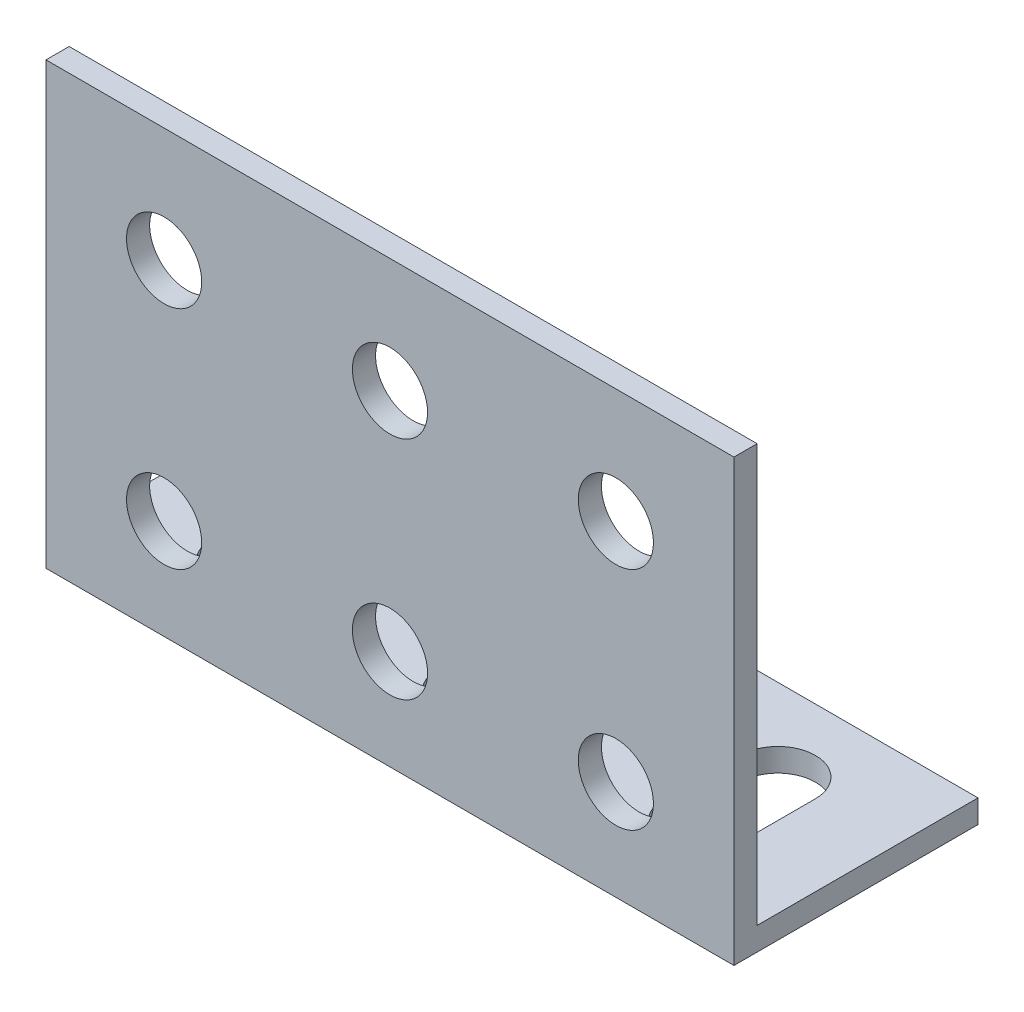
from build123d import *

# Parameters (mm, degrees)
SKETCH1_W           = 38.62
SKETCH1_H           = 24.72
SKETCH1_R           = 2.11
BOSS_EXTRUDE1_DEPTH = 1.3
SKETCH2_W           = 38.62
SKETCH2_H           = 13.7
BOSS_EXTRUDE2_DEPTH = 1.3


with BuildPart() as part:
    # Sketch1 → Boss-Extrude1 (new body)
    with BuildSketch(Plane.XY):
        with Locations((-21.272112536, 4.996529857)):
            Rectangle(SKETCH1_W, SKETCH1_H)
        with Locations((-33.952112536, 10.926529857)):
            Circle(SKETCH1_R, mode=Mode.SUBTRACT)
        with Locations((-21.272112536, 10.926529857)):
            Circle(SKETCH1_R, mode=Mode.SUBTRACT)
        with Locations((-8.592112536, 10.926529857)):
            Circle(SKETCH1_R, mode=Mode.SUBTRACT)
        with Locations((-21.272112536, -1.753470143)):
            Circle(SKETCH1_R, mode=Mode.SUBTRACT)
        with Locations((-8.592112536, -1.753470143)):
            Circle(SKETCH1_R, mode=Mode.SUBTRACT)
        with Locations((-33.952112536, -1.753470143)):
            Circle(SKETCH1_R, mode=Mode.SUBTRACT)
    extrude(amount=-BOSS_EXTRUDE1_DEPTH)

    # Sketch2 → Boss-Extrude2 (add)
    with BuildSketch(Plane.XZ.offset(7.363470143)):
        with Locations((-21.272112536, -6.85)):
            Rectangle(SKETCH2_W, SKETCH2_H)
        with BuildLine():
            Line((-31.842112536, -4.791404459), (-31.842112536, -9.091404459))
            ThreePointArc((-31.842112536, -9.091404459), (-33.952112536, -11.201404459), (-36.062112536, -9.091404459))
            Line((-36.062112536, -9.091404459), (-36.062112536, -4.791404459))
            ThreePointArc((-36.062112536, -4.791404459), (-33.952112536, -2.681404459), (-31.842112536, -4.791404459))
        make_face(mode=Mode.SUBTRACT)
        with BuildLine():
            Line((-19.162112536, -4.791404459), (-19.162112536, -9.091404459))
            ThreePointArc((-19.162112536, -9.091404459), (-21.272112536, -11.201404459), (-23.382112536, -9.091404459))
            Line((-23.382112536, -9.091404459), (-23.382112536, -4.791404459))
            ThreePointArc((-23.382112536, -4.791404459), (-21.272112536, -2.681404459), (-19.162112536, -4.791404459))
        make_face(mode=Mode.SUBTRACT)
        with BuildLine():
            Line((-6.482112536, -4.791404459), (-6.482112536, -9.091404459))
            ThreePointArc((-6.482112536, -9.091404459), (-8.592112536, -11.201404459), (-10.702112536, -9.091404459))
            Line((-10.702112536, -9.091404459), (-10.702112536, -4.791404459))
            ThreePointArc((-10.702112536, -4.791404459), (-8.592112536, -2.681404459), (-6.482112536, -4.791404459))
        make_face(mode=Mode.SUBTRACT)
    extrude(amount=-BOSS_EXTRUDE2_DEPTH)


solid = part.part
